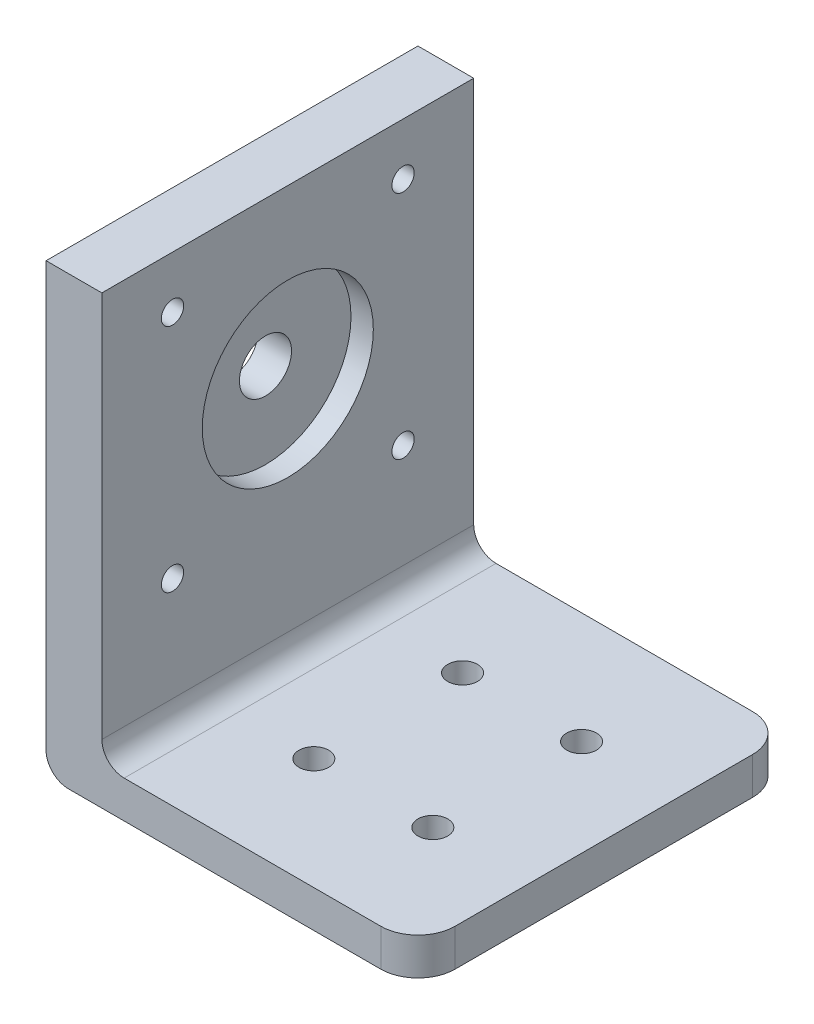
from build123d import *

# Parameters (mm, degrees)
BOSS_EXTRUDE1_DEPTH = 5
SKETCH2_W           = 7.5
SKETCH2_H           = 50
BOSS_EXTRUDE2_DEPTH = 55
FILLET1_R           = 3
FILLET2_R           = 3
SKETCH3_R           = 1.5
SKETCH3_R_2         = 3.5
CUT_EXTRUDE1_DEPTH  = 83.006097334
SKETCH4_R           = 11.5
CUT_EXTRUDE2_DEPTH  = 3
SKETCH6_R           = 2
CUT_EXTRUDE3_DEPTH  = 66.383484153


with BuildPart() as part:
    # Sketch1 → Boss-Extrude1 (new body)
    with BuildSketch(Plane(origin=(0, 0, 0), x_dir=(1, 0, 0), z_dir=(0, 1, 0))):
        with BuildLine():
            Line((-25, 25), (20, 25))
            ThreePointArc((20, 25), (23.535533906, 23.535533906), (25, 20))
            Line((25, 20), (25, -20))
            ThreePointArc((25, -20), (23.535533906, -23.535533906), (20, -25))
            Line((20, -25), (-25, -25))
            Line((-25, -25), (-25, 25))
        make_face()
    extrude(amount=BOSS_EXTRUDE1_DEPTH)

    # Sketch2 → Boss-Extrude2 (add)
    with BuildSketch(Plane(origin=(0, 5, 0), x_dir=(1, 0, 0), z_dir=(0, 1, 0))):
        with Locations((-21.25, 0)):
            Rectangle(SKETCH2_W, SKETCH2_H)
    extrude(amount=BOSS_EXTRUDE2_DEPTH)

    # Fillet1
    fillet1_edges = [part.edges().sort_by_distance(p)[0] for p in [
        (-17.5, 5, 0),
    ]]
    fillet(fillet1_edges, radius=FILLET1_R)

    # Fillet2
    fillet2_edges = [part.edges().sort_by_distance(p)[0] for p in [
        (-25, 0, 0),
    ]]
    fillet(fillet2_edges, radius=FILLET2_R)

    # Sketch3 → Cut-Extrude1 (cut, through all)
    with BuildSketch(Plane.ZY.offset(25)):
        with Locations((15.5, 53)):
            Circle(SKETCH3_R)
        with Locations(Location((-15.5, 53, 0), (0, 0, 180))):
            Circle(SKETCH3_R)
        with Locations((0, 37.5)):
            Circle(SKETCH3_R_2)
        with Locations(Location((15.5, 22, 0), (0, 0, 180))):
            Circle(SKETCH3_R)
        with Locations((-15.5, 22)):
            Circle(SKETCH3_R)
    extrude(amount=-CUT_EXTRUDE1_DEPTH, mode=Mode.SUBTRACT)

    # Sketch4 → Cut-Extrude2 (cut)
    with BuildSketch(Plane(origin=(-17.5, 0, 0), x_dir=(0, 0, -1), z_dir=(1, 0, 0))):
        with Locations((0, 37.5)):
            Circle(SKETCH4_R)
    extrude(amount=-CUT_EXTRUDE2_DEPTH, mode=Mode.SUBTRACT)

    # Sketch6 → Cut-Extrude3 (cut, through all)
    with BuildSketch(Plane(origin=(0, 5, 0), x_dir=(1, 0, 0), z_dir=(0, 1, 0))):
        with Locations(Location((12, -10, 0), (0, 0, 270))):
            Circle(SKETCH6_R)
        with Locations(Location((-4, -10, 0), (0, 0, 270))):
            Circle(SKETCH6_R)
        with Locations(Location((12, 10, 0), (0, 0, 90))):
            Circle(SKETCH6_R)
        with Locations(Location((-4, 10, 0), (0, 0, 90))):
            Circle(SKETCH6_R)
    extrude(amount=-CUT_EXTRUDE3_DEPTH, mode=Mode.SUBTRACT)


solid = part.part
